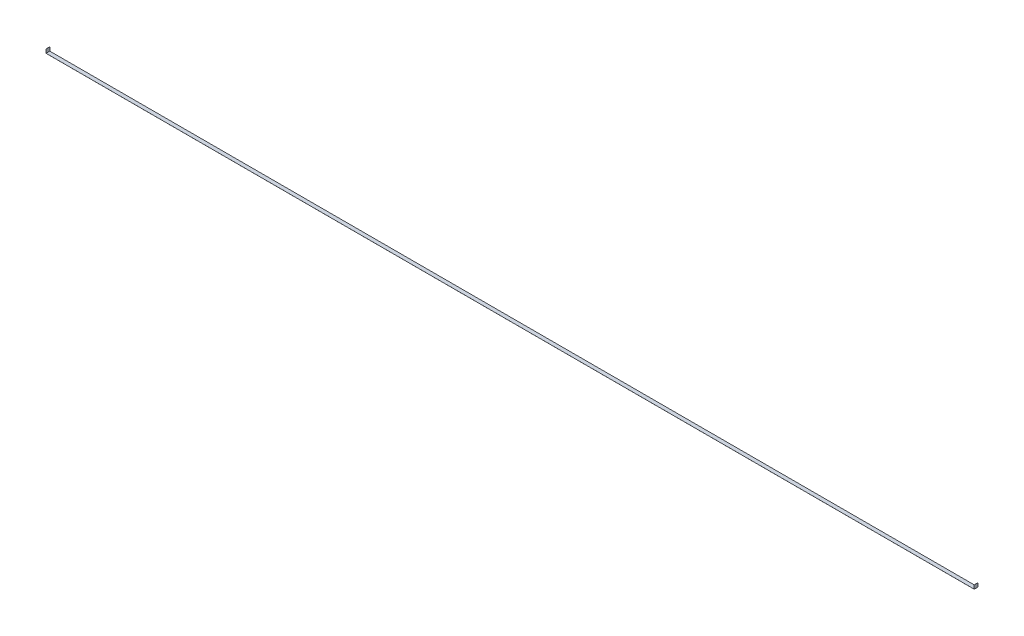
from build123d import *

# Parameters (mm, degrees)
EXTRUDE_THIN1_DEPTH = 25.4


with BuildPart() as part:
    # Sketch1 → Extrude-Thin1 (new body)
    with BuildSketch(Plane.XY):
        Polygon((-3136.9, 25.4), (-3136.9, 0), (3136.9, 0), (3136.9, 25.4), (3137.154, 25.4), (3137.154, -0.254), (-3137.154, -0.254), (-3137.154, 25.4), align=None)
    extrude(amount=EXTRUDE_THIN1_DEPTH)


solid = part.part
